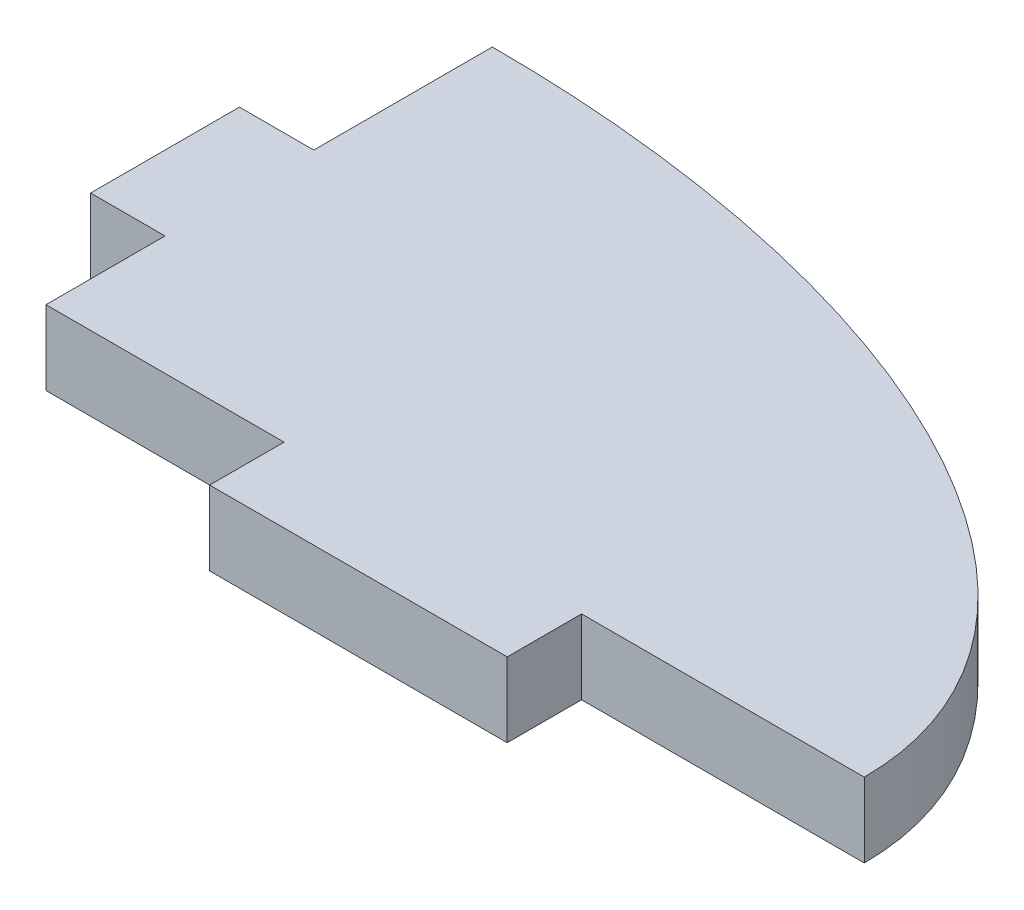
from build123d import *

# Parameters (mm, degrees)
BOSS_EXTRUDE2_DEPTH = 3.175
SKETCH6_W           = 3.175
SKETCH6_H           = 6.35
SKETCH6_W_2         = 12.7
SKETCH6_H_2         = 3.175
BOSS_EXTRUDE4_DEPTH = 3.175


with BuildPart() as part:
    # Sketch5 → Boss-Extrude2 (new body)
    with BuildSketch(Plane(origin=(0, 0, 0), x_dir=(1, 0, 0), z_dir=(0, 1, 0))):
        with BuildLine():
            Line((0, 0), (0, 19.05))
            add(Edge.make_bspline(
                [(34.925, 0), (34.925, 19.05), (0, 19.05)],
                knots=[3.141592654, 3.141592654, 3.141592654, 4.71238898, 4.71238898, 4.71238898], degree=2, weights=[1, 0.707106781, 1]))
            Line((34.925, 0), (0, 0))
        make_face()
    extrude(amount=BOSS_EXTRUDE2_DEPTH)

    # Sketch6 → Boss-Extrude4 (add)
    with BuildSketch(Plane(origin=(0, 3.175, 0), x_dir=(1, 0, 0), z_dir=(0, 1, 0))):
        with Locations((-1.5875, 8.255)):
            Rectangle(SKETCH6_W, SKETCH6_H)
        with Locations((16.51, -1.5875)):
            Rectangle(SKETCH6_W_2, SKETCH6_H_2)
    extrude(amount=-BOSS_EXTRUDE4_DEPTH)


solid = part.part
